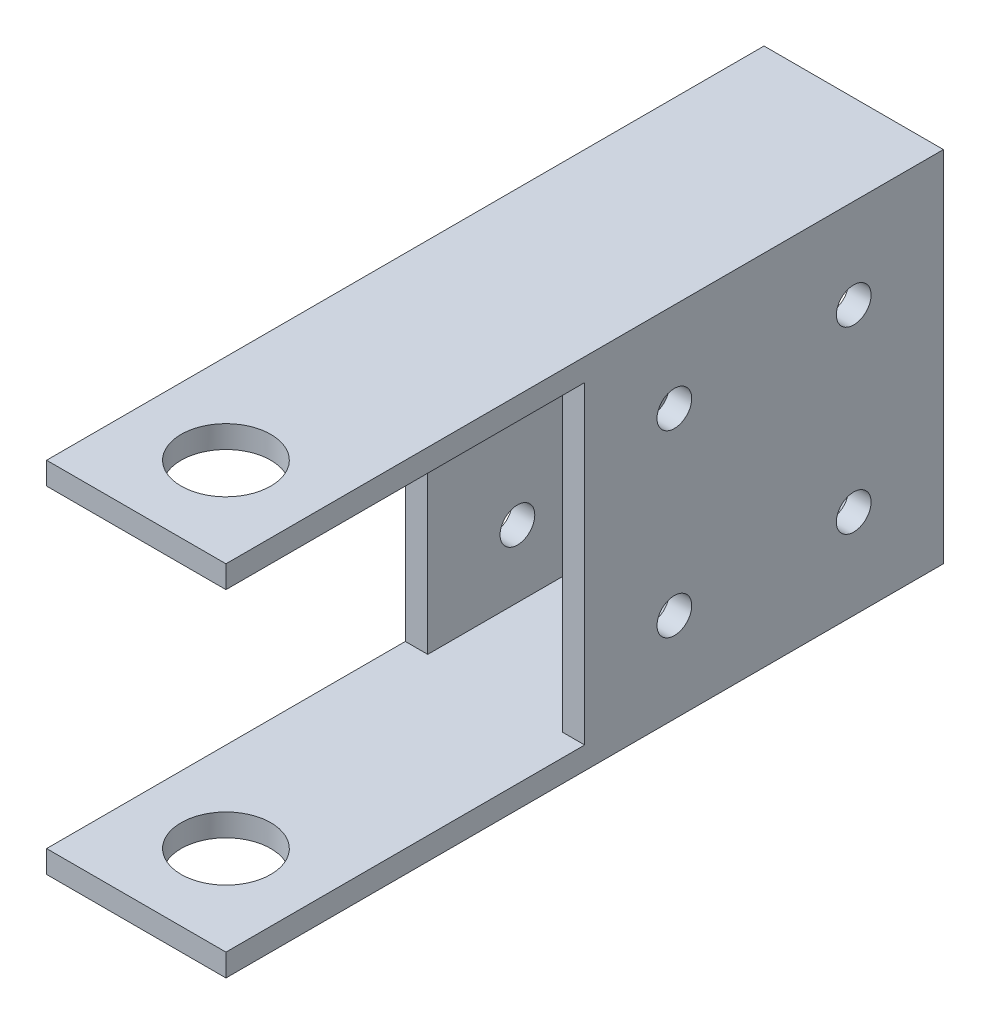
from build123d import *

# Parameters (mm, degrees)
SKETCH2_W                    = 25.4
SKETCH2_H                    = 50.8
BOSS_EXTRUDE1_DEPTH          = 50.8
SKETCH3_W                    = 50.8
SKETCH3_H                    = 44.45
CUT_EXTRUDE1_DEPTH           = 63.217039467
SKETCH4_R                    = 6.35
CUT_EXTRUDE2_DEPTH           = 73.955945611
F_10_0_1935_DIAMETER_HOLE2_D = 4.9149
SKETCH9_W                    = 19.05
SKETCH9_H                    = 44.45
CUT_EXTRUDE3_DEPTH           = 106.494123059


with BuildPart() as part:
    # Sketch2 → Boss-Extrude1 (new, symmetric)
    with BuildSketch(Plane.XY):
        Rectangle(SKETCH2_W, SKETCH2_H)
    extrude(amount=BOSS_EXTRUDE1_DEPTH, both=True)

    # Sketch3 → Cut-Extrude1 (cut, through all)
    with BuildSketch(Plane(origin=(12.7, 0, 0), x_dir=(0, 0, -1), z_dir=(1, 0, 0))):
        with Locations((-25.4, 0)):
            Rectangle(SKETCH3_W, SKETCH3_H)
    extrude(amount=-CUT_EXTRUDE1_DEPTH, mode=Mode.SUBTRACT)

    # Sketch4 → Cut-Extrude2 (cut, through all)
    with BuildSketch(Plane(origin=(0, 25.4, 0), x_dir=(1, 0, 0), z_dir=(0, 1, 0))):
        with Locations(Location((0, -38.1, 0), (0, 0, 270))):
            Circle(SKETCH4_R)
    extrude(amount=-CUT_EXTRUDE2_DEPTH, mode=Mode.SUBTRACT)

    # #10 (0.1935) Diameter Hole2 (through all)
    with Locations(Plane(origin=(12.7, 0, 0), x_dir=(0, 0, -1), z_dir=(1, 0, 0))):
        with Locations((12.7, 12.7), (38.1, 12.7), (12.7, -12.7), (38.1, -12.7)):
            Hole(F_10_0_1935_DIAMETER_HOLE2_D / 2)

    # Sketch9 → Cut-Extrude3 (cut, through all)
    with BuildSketch(Plane(origin=(0, 0, -50.8), x_dir=(-1, 0, 0), z_dir=(0, 0, -1))):
        Rectangle(SKETCH9_W, SKETCH9_H)
    extrude(amount=-CUT_EXTRUDE3_DEPTH, mode=Mode.SUBTRACT)


solid = part.part
